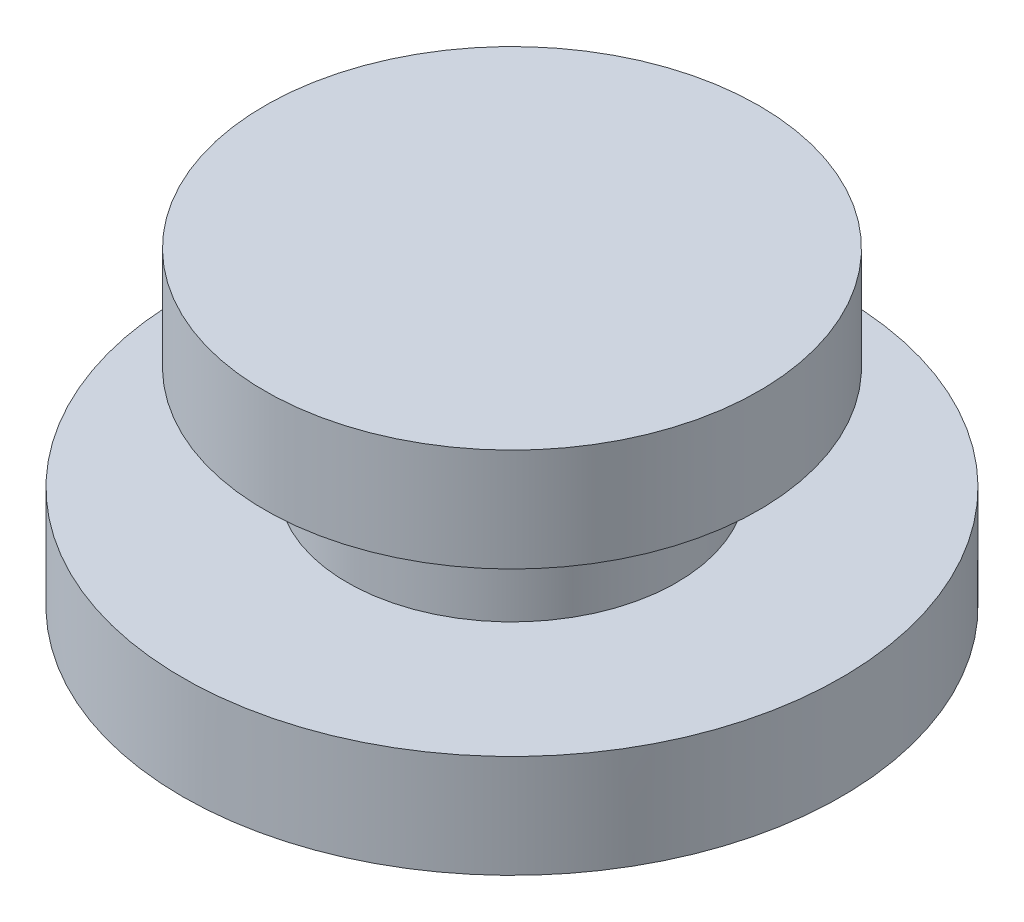
from build123d import *


with BuildPart() as part:
    # Sketch2 → Revolve1 (revolve)
    with BuildSketch(Plane(origin=(0, 0, 0), x_dir=(0, 0, -1), z_dir=(1, 0, 0))):
        Polygon((0, 110), (120, 110), (120, 60), (80, 60), (80, 9.474411167), (160, 9.474411167), (160, -40.525588833), (50, -70), (50, -110), (0, -110), align=None)
    revolve(axis=Axis((0, -110, 0), (0, 1, 0)))


solid = part.part
